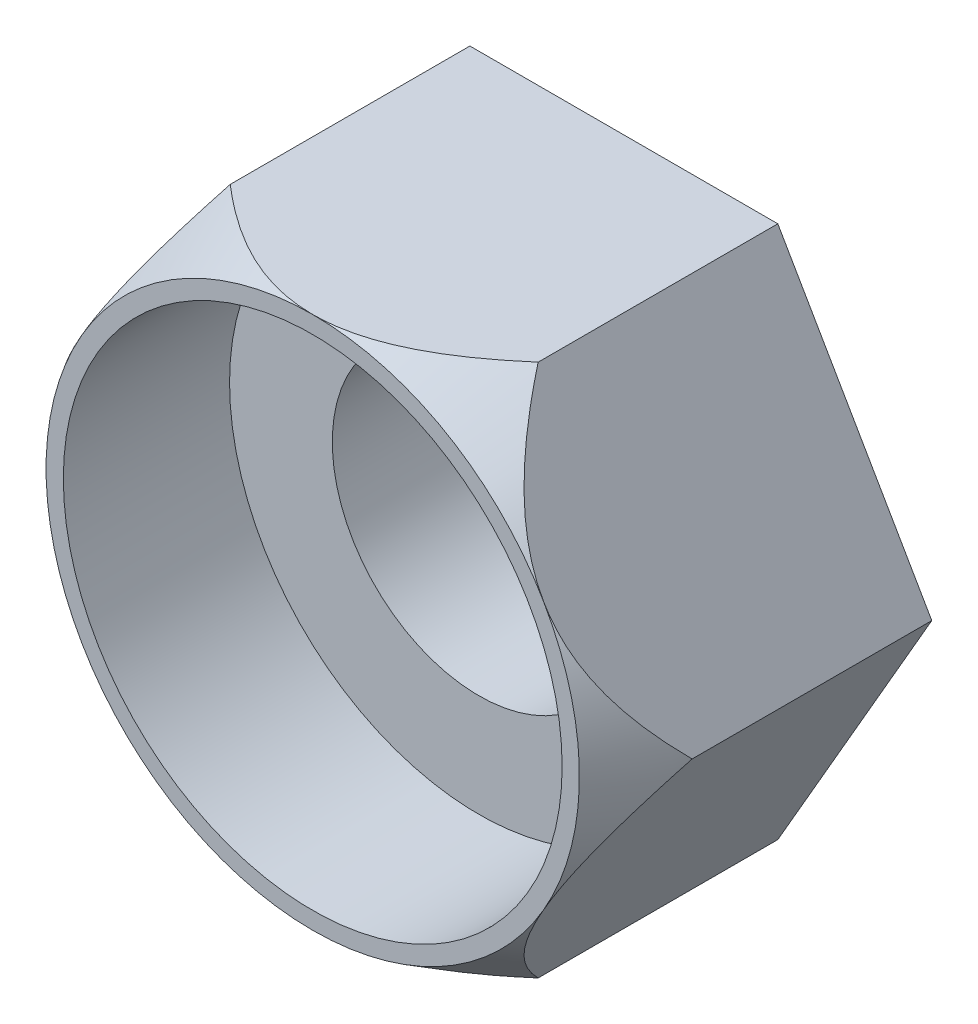
from build123d import *

# Parameters (mm, degrees)
BOSS_EXTRUDE1_DEPTH                      = 17.5
SKETCH3_OUTSIDE_W                        = 131.318
SKETCH3_OUTSIDE_H                        = 122.036
SKETCH3_OUTSIDE_R                        = 30
CUT_EXTRUDE1_DEPTH                       = 17.5
CUT_EXTRUDE1_TAPER                       = 30
CUT_EXTRUDE1_OTHER_WAY_DEPTH             = 17.5
CUT_EXTRUDE1_OTHER_WAY_TAPER             = 30
CBORE_FOR_M30_HEX_HEAD_BOLT1_D           = 33
CBORE_FOR_M30_HEX_HEAD_BOLT1_CBORE_D     = 56.116
CBORE_FOR_M30_HEX_HEAD_BOLT1_CBORE_DEPTH = 18.7


with BuildPart() as part:
    # Sketch2 → Boss-Extrude1 (new, symmetric)
    with BuildSketch(Plane.XY):
        Polygon((34.641016151, 0), (17.320508076, 30), (-17.320508076, 30), (-34.641016151, 0), (-17.320508076, -30), (17.320508076, -30), align=None)
    extrude(amount=BOSS_EXTRUDE1_DEPTH, both=True)

    # Sketch3 outside → Cut-Extrude1 (cut)
    with BuildSketch(Plane.XY.offset(17.5)):
        Rectangle(SKETCH3_OUTSIDE_W, SKETCH3_OUTSIDE_H)
        Circle(SKETCH3_OUTSIDE_R, mode=Mode.SUBTRACT)
    extrude(amount=CUT_EXTRUDE1_DEPTH, taper=CUT_EXTRUDE1_TAPER, mode=Mode.SUBTRACT)

    # Sketch3 outside → Cut-Extrude1 other way (cut)
    with BuildSketch(Plane.XY.offset(17.5)):
        Rectangle(SKETCH3_OUTSIDE_W, SKETCH3_OUTSIDE_H)
        Circle(SKETCH3_OUTSIDE_R, mode=Mode.SUBTRACT)
    extrude(amount=-CUT_EXTRUDE1_OTHER_WAY_DEPTH, taper=CUT_EXTRUDE1_OTHER_WAY_TAPER, mode=Mode.SUBTRACT)

    # CBORE for M30 Hex Head Bolt1 (through all)
    with Locations(Plane.XY.offset(17.5)):
        with Locations((0, 0)):
            CounterBoreHole(CBORE_FOR_M30_HEX_HEAD_BOLT1_D / 2, CBORE_FOR_M30_HEX_HEAD_BOLT1_CBORE_D / 2, CBORE_FOR_M30_HEX_HEAD_BOLT1_CBORE_DEPTH)


solid = part.part
